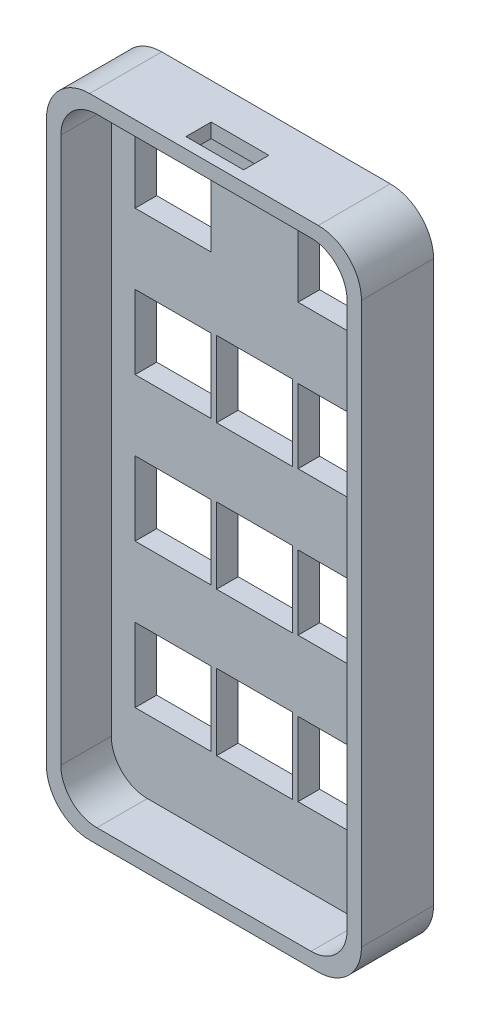
from build123d import *

# Parameters (mm, degrees)
SKETCH_1_W             = 39.7
SKETCH_1_H             = 85.7
EXTRUDE_1_DEPTH        = 3
SKETCH_3_W             = 10.5
SKETCH_3_H             = 10.25
SKETCH_3_H_2           = 10.5
CUT_EXTRUDE_1_DEPTH    = 3
EXTRUDE_1_2_DEPTH      = 7
EXTRUDE_1_2_DEPTH_BACK = 3
SKETCH_6_W             = 43.7
SKETCH_6_H             = 89.7
SKETCH_6_W_2           = 39.7
SKETCH_6_H_2           = 85.7
FILLET_1_R             = 6
SKETCH_7_W             = 8
SKETCH_7_H             = 3.5
CUT_EXTRUDE_2_DEPTH    = 7
FILLET_2_R             = 5
FILLET_3_R             = 5
SKETCH_8_W             = 10.5
SKETCH_8_H             = 10.5
EXTRUDE_2_DEPTH        = 3
SKETCH_9_W             = 37.1
SKETCH_9_H             = 8
CUT_EXTRUDE_3_DEPTH    = 0.6


with BuildPart() as part:
    # 스케치1 → Extrude 1 (new body)
    with BuildSketch(Plane.XY):
        Rectangle(SKETCH_1_W, SKETCH_1_H)
    extrude(amount=EXTRUDE_1_DEPTH)

    # 스케치3 → 컷-돌출1 (cut)
    with BuildSketch(Plane(origin=(0, 0, 0), x_dir=(-1, 0, 0), z_dir=(0, 0, -1))):
        with Locations((-11.3, 32.35)):
            Rectangle(SKETCH_3_W, SKETCH_3_H)
        with Locations((-11.3, 12.35)):
            Rectangle(SKETCH_3_W, SKETCH_3_H)
        with Locations((11.3, 32.35)):
            Rectangle(SKETCH_3_W, SKETCH_3_H)
        with Locations((0, 32.35)):
            Rectangle(SKETCH_3_W, SKETCH_3_H_2)
        with Locations((0, 12.35)):
            Rectangle(SKETCH_3_W, SKETCH_3_H_2)
        with Locations((11.3, 12.35)):
            Rectangle(SKETCH_3_W, SKETCH_3_H)
        with Locations((-11.3, -7.65)):
            Rectangle(SKETCH_3_W, SKETCH_3_H)
        with Locations((0, -7.65)):
            Rectangle(SKETCH_3_W, SKETCH_3_H_2)
        with Locations((11.3, -7.65)):
            Rectangle(SKETCH_3_W, SKETCH_3_H)
        with Locations((-11.3, -27.65)):
            Rectangle(SKETCH_3_W, SKETCH_3_H)
        with Locations((0, -27.65)):
            Rectangle(SKETCH_3_W, SKETCH_3_H_2)
        with Locations((11.3, -27.65)):
            Rectangle(SKETCH_3_W, SKETCH_3_H)
    extrude(amount=-CUT_EXTRUDE_1_DEPTH, mode=Mode.SUBTRACT)

    # 스케치6 → Extrude 1 2 (add, two sides: drawn at the far end of the back side and taken through both)
    with BuildSketch(Plane.XY.offset(3).offset(-EXTRUDE_1_2_DEPTH_BACK)):
        Rectangle(SKETCH_6_W, SKETCH_6_H)
        Rectangle(SKETCH_6_W_2, SKETCH_6_H_2, mode=Mode.SUBTRACT)
    extrude(amount=EXTRUDE_1_2_DEPTH + EXTRUDE_1_2_DEPTH_BACK)

    # 필렛1
    fillet_1_edges = [part.edges().sort_by_distance(p)[0] for p in [
        (21.85, 44.85, 5),
        (21.85, -44.85, 5),
        (-21.85, -44.85, 5),
        (-21.85, 44.85, 5),
    ]]
    fillet(fillet_1_edges, radius=FILLET_1_R)

    # 스케치7 → 컷-돌출2 (cut)
    with BuildSketch(Plane(origin=(0, 44.85, 0), x_dir=(1, 0, 0), z_dir=(0, 1, 0))):
        with Locations((0, -6.75)):
            Rectangle(SKETCH_7_W, SKETCH_7_H)
    extrude(amount=-CUT_EXTRUDE_2_DEPTH, mode=Mode.SUBTRACT)

    # 필렛2
    fillet_2_edges = [part.edges().sort_by_distance(p)[0] for p in [
        (-19.85, 42.85, 6.5),
        (19.85, 42.85, 6.5),
    ]]
    fillet(fillet_2_edges, radius=FILLET_2_R)

    # 필렛3
    fillet_3_edges = [part.edges().sort_by_distance(p)[0] for p in [
        (19.85, -42.85, 6.5),
        (-19.85, -42.85, 6.5),
    ]]
    fillet(fillet_3_edges, radius=FILLET_3_R)

    # 스케치8 → 보스-돌출2 (add)
    with BuildSketch(Plane(origin=(0, 0, 0), x_dir=(-1, 0, 0), z_dir=(0, 0, -1))):
        with Locations((0, 32.35)):
            Rectangle(SKETCH_8_W, SKETCH_8_H)
    extrude(amount=-EXTRUDE_2_DEPTH)

    # 스케치9 → 컷-돌출3 (cut)
    with BuildSketch(Plane(origin=(0, 0, 0), x_dir=(-1, 0, 0), z_dir=(0, 0, -1))):
        with Locations((0, 2.35)):
            Rectangle(SKETCH_9_W, SKETCH_9_H)
        with Locations((0, 22.35)):
            Rectangle(SKETCH_9_W, SKETCH_9_H)
        with Locations((0, -17.65)):
            Rectangle(SKETCH_9_W, SKETCH_9_H)
        with Locations((0, -37.65)):
            Rectangle(SKETCH_9_W, SKETCH_9_H)
    extrude(amount=-CUT_EXTRUDE_3_DEPTH, mode=Mode.SUBTRACT)


solid = part.part
